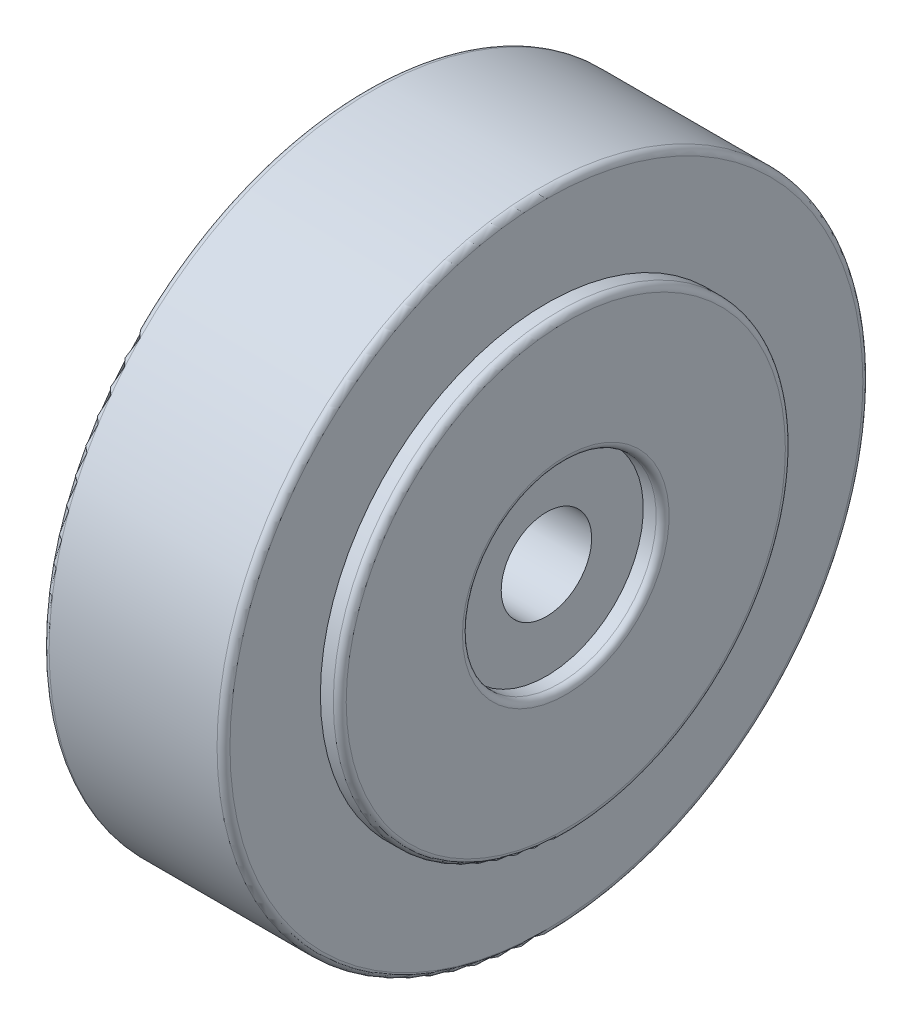
from build123d import *

# Parameters (mm, degrees)
FILLET1_R = 1


with BuildPart() as part:
    # Sketch1 → Revolve1 (revolve)
    with BuildSketch(Plane.XY, mode=Mode.PRIVATE) as revolve1_sk:
        Polygon((14, 7), (14, 15), (17, 15), (17, 35), (14, 35), (14, 50), (-14, 50), (-14, 35), (-17, 35), (-17, 15), (-14, 15), (-14, 7), align=None)
    revolve(revolve1_sk.sketch.rotate(Axis((0, 0, 0), (1, 0, 0)), 90), axis=Axis((0, 0, 0), (1, 0, 0)))

    # Fillet1
    fillet1_edges = [part.edges().sort_by_distance(p)[0] for p in [
        (-17, 0, -15),
        (-17, 0, -35),
        (-14, 0, -50),
        (14, 0, -50),
        (17, 0, -35),
        (17, 0, -15),
    ]]
    fillet(fillet1_edges, radius=FILLET1_R)


solid = part.part
